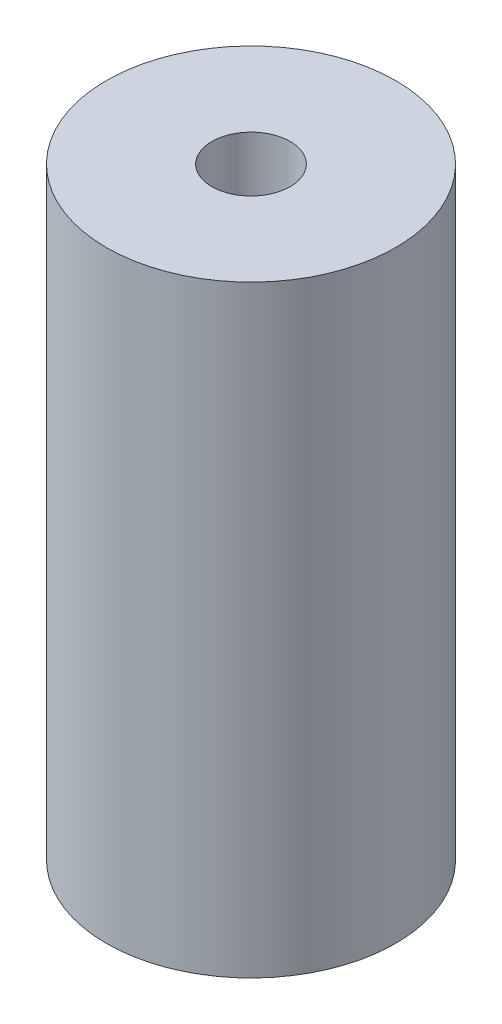
from build123d import *

# Parameters (mm, degrees)
SKETCH1_R           = 12
SKETCH1_R_2         = 3.25
BOSS_EXTRUDE1_DEPTH = 25


with BuildPart() as part:
    # Sketch1 → Boss-Extrude1 (new, symmetric)
    with BuildSketch(Plane(origin=(0, 0, 0), x_dir=(1, 0, 0), z_dir=(0, 1, 0))):
        with Locations(Location((0, 0, 0), (0, 0, 270))):
            Circle(SKETCH1_R)
        with Locations(Location((0, 0, 0), (0, 0, 270))):
            Circle(SKETCH1_R_2, mode=Mode.SUBTRACT)
    extrude(amount=BOSS_EXTRUDE1_DEPTH, both=True)


solid = part.part
